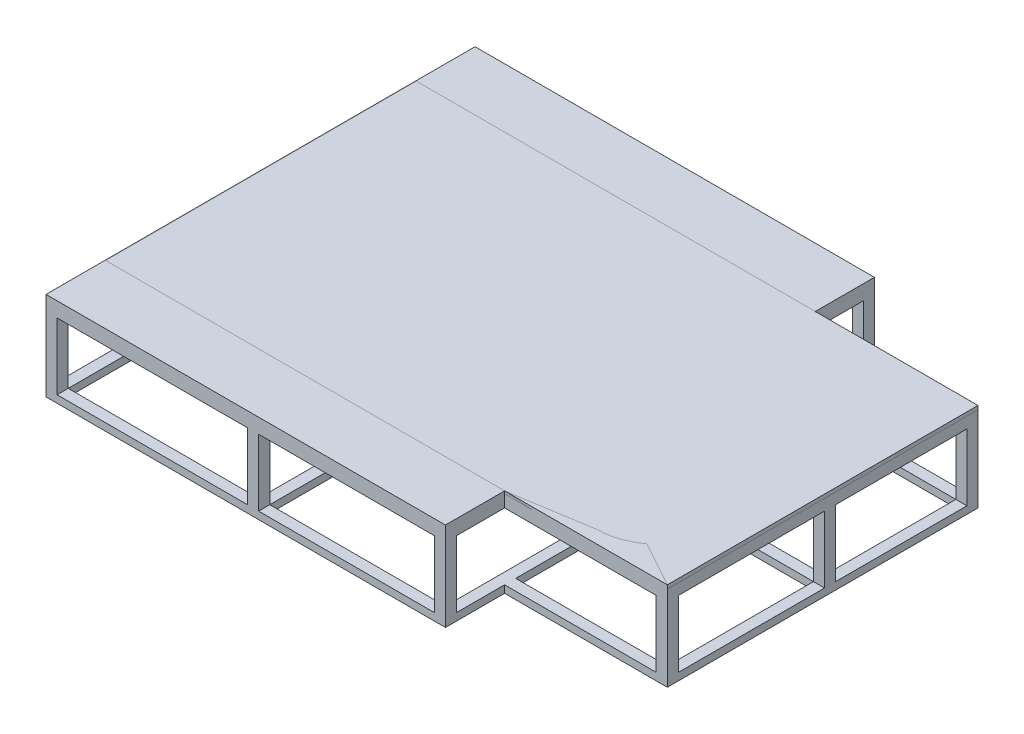
from build123d import *

# Parameters (mm, degrees)
SKETCH1_W           = 150.8125
SKETCH1_H           = 163.5125
SKETCH1_W_2         = 130.175
SKETCH1_H_2         = 125.4125
SKETCH1_H_3         = 112.7125
SKETCH1_W_3         = 163.5125
SKETCH1_H_4         = 176.2125
BOSS_EXTRUDE1_DEPTH = 6.35
SKETCH2_W           = 9.525
SKETCH2_H           = 9.525
SKETCH2_W_2         = 3.2584612
BOSS_EXTRUDE2_DEPTH = 69.85
SKETCH3_R           = 55.88
BOSS_EXTRUDE3_DEPTH = 12.7
SKETCH4_W           = 482.237345922
SKETCH4_H           = 3.175
BOSS_EXTRUDE4_DEPTH = 266.7


with BuildPart() as part:
    # Sketch1 → Boss-Extrude1 (new body)
    with BuildSketch(Plane(origin=(0, 0, 0), x_dir=(1, 0, 0), z_dir=(0, 1, 0))):
        Polygon((285.232758897, 259.212857244), (285.232758897, 310.012857244), (-57.667241103, 310.012857244), (-57.667241103, -58.287142756), (285.232758897, -58.287142756), (285.232758897, -7.487142756), (424.932758897, -7.487142756), (424.932758897, 259.212857244), align=None)
        with Locations((200.301508897, 218.731607244)):
            Rectangle(SKETCH1_W, SKETCH1_H, mode=Mode.SUBTRACT)
        with Locations((350.320258897, 64.744107244)):
            Rectangle(SKETCH1_W_2, SKETCH1_H_2, mode=Mode.SUBTRACT)
        with Locations((350.320258897, 193.331607244)):
            Rectangle(SKETCH1_W_2, SKETCH1_H_3, mode=Mode.SUBTRACT)
        with Locations((33.614008897, 218.731607244)):
            Rectangle(SKETCH1_W_3, SKETCH1_H, mode=Mode.SUBTRACT)
        with Locations((33.614008897, 39.344107244)):
            Rectangle(SKETCH1_W_3, SKETCH1_H_4, mode=Mode.SUBTRACT)
        with Locations((200.301508897, 39.344107244)):
            Rectangle(SKETCH1_W, SKETCH1_H_4, mode=Mode.SUBTRACT)
    extrude(amount=BOSS_EXTRUDE1_DEPTH)

    # Sketch2 → Boss-Extrude2 (add)
    with BuildSketch(Plane(origin=(0, 6.35, 0), x_dir=(1, 0, 0), z_dir=(0, 1, 0))):
        with Locations((-52.904741103, 305.250357244)):
            Rectangle(SKETCH2_W, SKETCH2_H)
        with Locations((113.741028297, 305.250357244)):
            Rectangle(SKETCH2_W_2, SKETCH2_H)
        with Locations((120.132758897, 132.212857244)):
            Rectangle(SKETCH2_W, SKETCH2_H)
        with Locations((-52.904741103, 132.212857244)):
            Rectangle(SKETCH2_W, SKETCH2_H)
        with Locations((-52.904741103, -53.524642756)):
            Rectangle(SKETCH2_W, SKETCH2_H)
        with Locations((120.132758897, -53.524642756)):
            Rectangle(SKETCH2_W, SKETCH2_H)
        with Locations((280.470258897, -53.524642756)):
            Rectangle(SKETCH2_W, SKETCH2_H)
        with Locations((280.470258897, 132.212857244)):
            Rectangle(SKETCH2_W, SKETCH2_H)
        with Locations((280.470258897, 305.250357244)):
            Rectangle(SKETCH2_W, SKETCH2_H)
        with Locations((420.170258897, 254.450357244)):
            Rectangle(SKETCH2_W, SKETCH2_H)
        with Locations((420.170258897, -2.724642756)):
            Rectangle(SKETCH2_W, SKETCH2_H)
        with Locations((420.170258897, 132.212857244)):
            Rectangle(SKETCH2_W, SKETCH2_H)
    extrude(amount=BOSS_EXTRUDE2_DEPTH)

    # Sketch3 → Boss-Extrude3 (add)
    with BuildSketch(Plane(origin=(0, 76.2, 0), x_dir=(1, 0, 0), z_dir=(0, 1, 0))):
        Polygon((115.370258897, -58.287142756), (115.370258897, -48.762142756), (124.895258897, -48.762142756), (124.895258897, -58.287142756), (285.232758897, -58.287142756), (285.232758897, -7.487142756), (424.932758897, -7.487142756), (424.932758897, 259.212857244), (285.232758897, 259.212857244), (285.232758897, 310.012857244), (-57.667241103, 310.012857244), (-57.667241103, -58.287142756), align=None)
        with Locations((28.845158897, 59.187857244)):
            Circle(SKETCH3_R, mode=Mode.SUBTRACT)
        with Locations((28.845158897, 195.712857244)):
            Circle(SKETCH3_R, mode=Mode.SUBTRACT)
        with Locations((200.206258897, 59.187857244)):
            Circle(SKETCH3_R, mode=Mode.SUBTRACT)
        with Locations((200.206258897, 195.712857244)):
            Circle(SKETCH3_R, mode=Mode.SUBTRACT)
        with Locations((352.542758897, 59.187857244)):
            Circle(SKETCH3_R, mode=Mode.SUBTRACT)
        with Locations((352.542758897, 195.712857244)):
            Circle(SKETCH3_R, mode=Mode.SUBTRACT)
    extrude(amount=-BOSS_EXTRUDE3_DEPTH)


with BuildPart() as body_2:
    # Sketch4 → Boss-Extrude4 (new body)
    with BuildSketch(Plane(origin=(0, 0, -259.212857244), x_dir=(-1, 0, 0), z_dir=(0, 0, -1))):
        with Locations((-183.814085936, 74.6125)):
            Rectangle(SKETCH4_W, SKETCH4_H)
    extrude(amount=-BOSS_EXTRUDE4_DEPTH)


solid = Compound([part.part, body_2.part])
